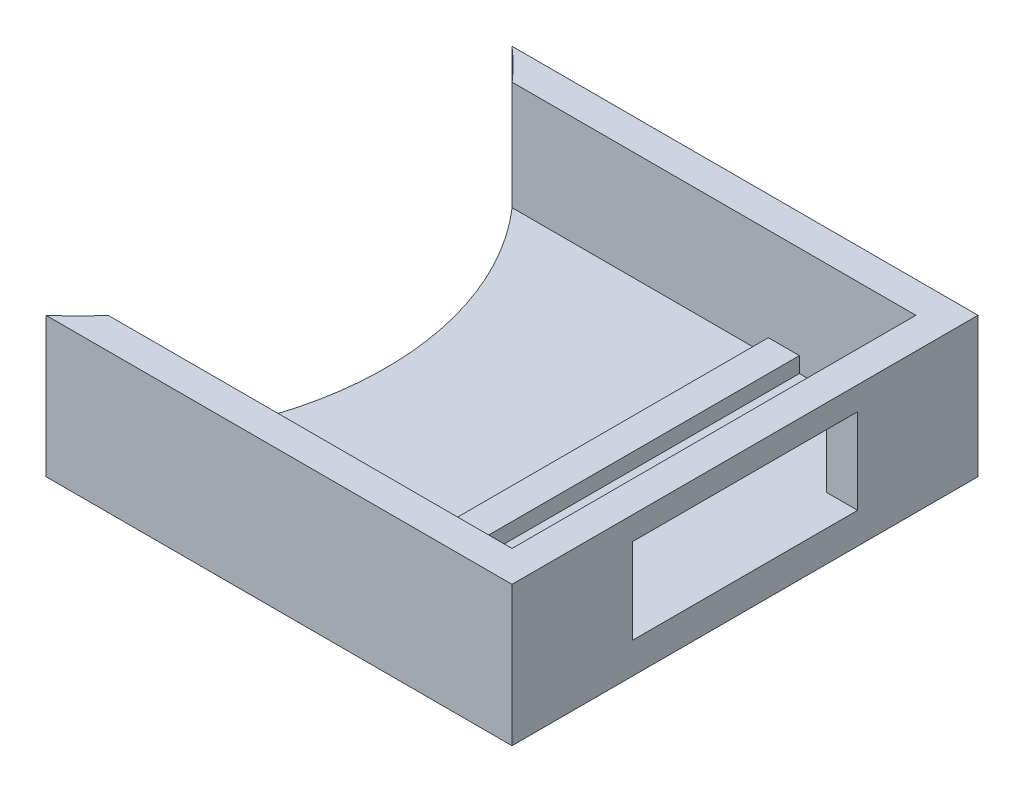
from build123d import *

# Parameters (mm, degrees)
EXTRUDE_1_DEPTH     = 2
EXTRUDE_2_DEPTH     = 7
SKETCH_3_W          = 14.5
SKETCH_3_H          = 5.5
CUT_EXTRUDE_1_DEPTH = 2
SKETCH_4_W          = 2
SKETCH_4_H          = 26
EXTRUDE_3_DEPTH     = 1


with BuildPart() as part:
    # 草图1 → 凸台-拉伸1 (new body)
    with BuildSketch(Plane(origin=(0, 0, 0), x_dir=(1, 0, 0), z_dir=(0, 1, 0))):
        with BuildLine():
            Line((14.078397583, 18.946730462), (-15.921602417, 18.946730462))
            ThreePointArc((-15.921602417, 18.946730462), (-10.846789199, 12.197093132), (-9.045997954, 3.946730462))
            ThreePointArc((-9.045997954, 3.946730462), (-10.846789199, -4.303632207), (-15.921602417, -11.053269538))
            Line((-15.921602417, -11.053269538), (14.078397583, -11.053269538))
            Line((14.078397583, -11.053269538), (14.078397583, 18.946730462))
        make_face()
    extrude(amount=EXTRUDE_1_DEPTH)

    # 草图2 → 凸台-拉伸2 (add)
    with BuildSketch(Plane(origin=(0, 2, 0), x_dir=(1, 0, 0), z_dir=(0, 1, 0))):
        with BuildLine():
            Line((14.078397583, 18.946730462), (-15.921602417, 18.946730462))
            ThreePointArc((-15.921602417, 18.946730462), (-14.880689288, 17.982761022), (-13.911474192, 16.946730462))
            Line((-13.911474192, 16.946730462), (12.078397583, 16.946730462))
            Line((12.078397583, 16.946730462), (12.078397583, -9.053269538))
            Line((12.078397583, -9.053269538), (-13.911474192, -9.053269538))
            ThreePointArc((-13.911474192, -9.053269538), (-14.880689288, -10.089300097), (-15.921602417, -11.053269538))
            Line((-15.921602417, -11.053269538), (14.078397583, -11.053269538))
            Line((14.078397583, -11.053269538), (14.078397583, 18.946730462))
        make_face()
    extrude(amount=EXTRUDE_2_DEPTH)

    # 草图3 → 切除-拉伸1 (cut)
    with BuildSketch(Plane.ZY.offset(-12.078397583)):
        with Locations((-3.946730462, 4.75)):
            Rectangle(SKETCH_3_W, SKETCH_3_H)
    extrude(amount=-CUT_EXTRUDE_1_DEPTH, mode=Mode.SUBTRACT)

    # 草图4 → 凸台-拉伸3 (add)
    with BuildSketch(Plane(origin=(0, 2, 0), x_dir=(1, 0, 0), z_dir=(0, 1, 0))):
        with Locations((3.578397583, 3.946730462)):
            Rectangle(SKETCH_4_W, SKETCH_4_H)
    extrude(amount=EXTRUDE_3_DEPTH)


solid = part.part
